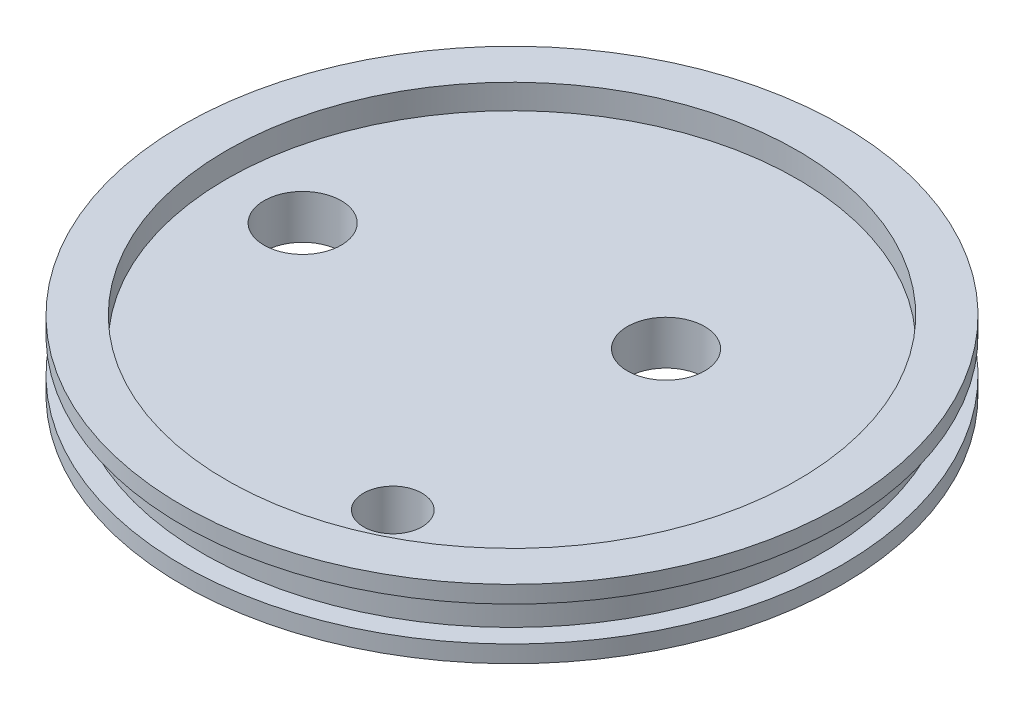
from build123d import *

# Parameters (mm, degrees)
PIPE_TAP_DRILL_FOR_1_4_TAP1_D = 11.1252
PIPE_TAP_DRILL_FOR_1_8_TAP1_D = 8.4328
SKETCH6_R                     = 6.35
BOSS_EXTRUDE1_DEPTH           = 6.35
PIPE_TAP_DRILL_FOR_1_4_TAP2_D = 11.1252


with BuildPart() as part:
    # Sketch1 → Revolve1 (revolve)
    with BuildSketch(Plane.XY, mode=Mode.PRIVATE) as revolve1_sk:
        Polygon((0, 0), (47.498, 0), (47.498, 2.4638), (44.577, 2.4638), (44.577, 7.4422), (47.498, 7.4422), (47.498, 9.906), (41.148, 9.906), (41.148, 6.35), (0, 6.35), align=None)
    revolve(revolve1_sk.sketch.rotate(Axis((0, 48.192213231, 0), (0, -1, 0)), 180), axis=Axis((0, 48.192213231, 0), (0, -1, 0)))

    # Pipe Tap Drill for 1/4 Tap1 (through all)
    with Locations(Plane(origin=(0, 6.35, 0), x_dir=(1, 0, 0), z_dir=(0, 1, 0))):
        with Locations((0, 0), (-30.1752, 0)):
            Hole(PIPE_TAP_DRILL_FOR_1_4_TAP1_D / 2)

    # Pipe Tap Drill for 1/8 Tap1 (through all)
    with Locations(Plane(origin=(0, 6.35, 0), x_dir=(1, 0, 0), z_dir=(0, 1, 0))):
        with Locations((12.150198978, -29.333175157)):
            Hole(PIPE_TAP_DRILL_FOR_1_8_TAP1_D / 2)

    # Sketch6 → Boss-Extrude1 (add)
    with BuildSketch(Plane(origin=(0, 6.35, 0), x_dir=(1, 0, 0), z_dir=(0, 1, 0))):
        Circle(SKETCH6_R)
    extrude(amount=-BOSS_EXTRUDE1_DEPTH)

    # Pipe Tap Drill for 1/4 Tap2 (through all)
    with Locations(Plane(origin=(0, 6.35, 0), x_dir=(1, 0, 0), z_dir=(0, 1, 0))):
        with Locations((11.714341144, 10.485870911)):
            Hole(PIPE_TAP_DRILL_FOR_1_4_TAP2_D / 2)


solid = part.part
